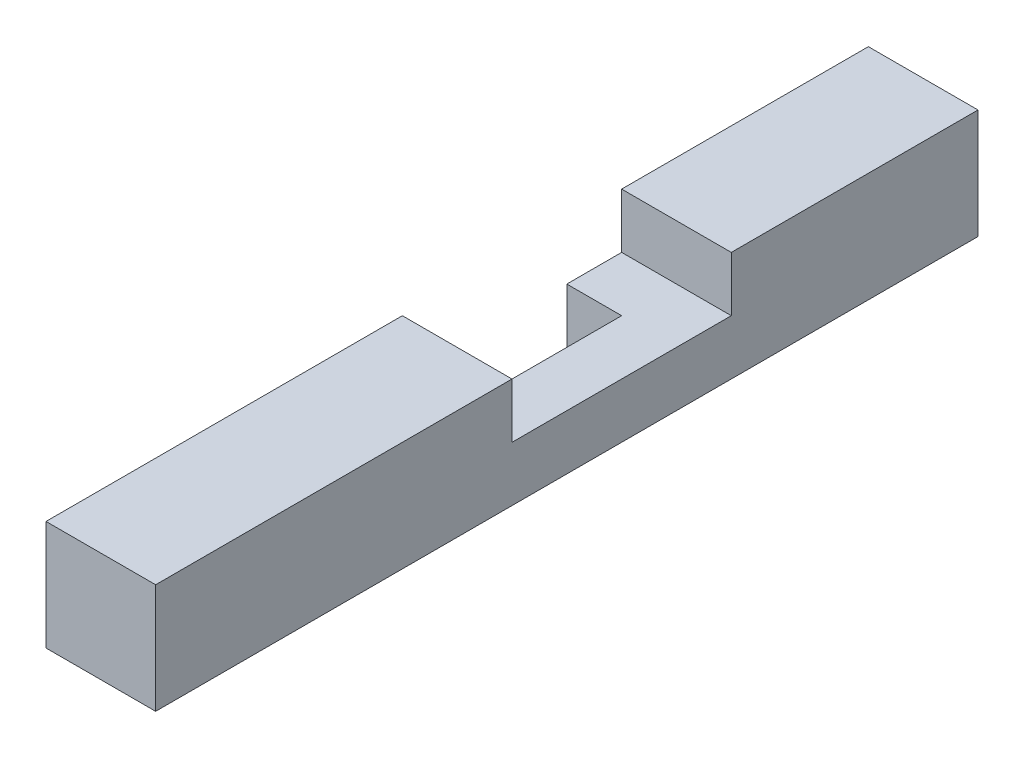
from build123d import *

# Parameters (mm, degrees)
SKETCH_1_W          = 4
SKETCH_1_H          = 4
EXTRUDE_1_DEPTH     = 30
SKETCH_4_W          = 8
SKETCH_4_H          = 2
CUT_EXTRUDE_1_DEPTH = 4
SKETCH_6_W          = 4
SKETCH_6_H          = 2
CUT_EXTRUDE_2_DEPTH = 2


with BuildPart() as part:
    # 草圖1 → 填料-伸長1 (new body)
    with BuildSketch(Plane.XY):
        Rectangle(SKETCH_1_W, SKETCH_1_H)
    extrude(amount=EXTRUDE_1_DEPTH)

    # 草圖4 → 除料-伸長1 (cut)
    with BuildSketch(Plane.ZY.offset(2)):
        with Locations((13, 1)):
            Rectangle(SKETCH_4_W, SKETCH_4_H)
    extrude(amount=-CUT_EXTRUDE_1_DEPTH, mode=Mode.SUBTRACT)

    # 草圖6 → 除料-伸長2 (cut)
    with BuildSketch(Plane.ZY.offset(2)):
        with Locations((13, -1)):
            Rectangle(SKETCH_6_W, SKETCH_6_H)
    extrude(amount=-CUT_EXTRUDE_2_DEPTH, mode=Mode.SUBTRACT)


solid = part.part
